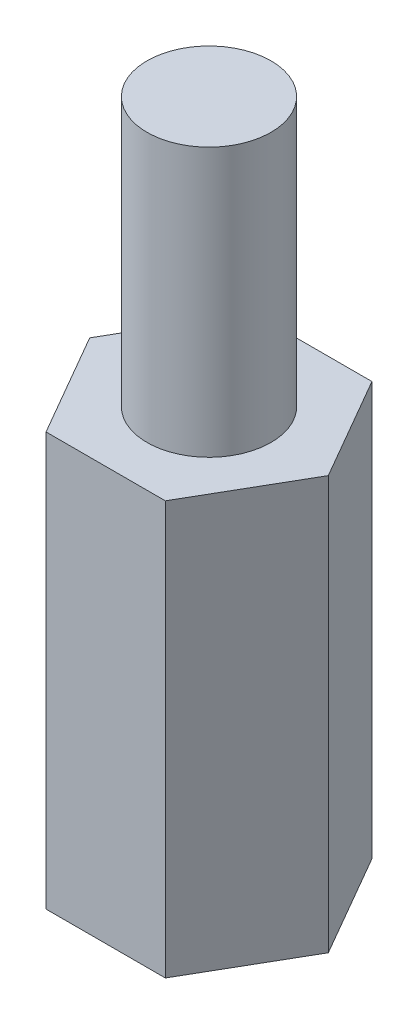
from build123d import *

# Parameters (mm, degrees)
EXTRUDE_1_DEPTH     = 10
SKETCH_2_R          = 1.5
EXTRUDE_2_DEPTH     = 6.5
SKETCH_3_R          = 1.5
CUT_EXTRUDE_1_DEPTH = 6.5


with BuildPart() as part:
    # ｽｹｯﾁ1 → ﾎﾞｽ - 押し出し1 (new body)
    with BuildSketch(Plane(origin=(0, 0, 0), x_dir=(1, 0, 0), z_dir=(0, 1, 0))):
        Polygon((1.443375673, -2.5), (2.886751346, 0), (1.443375673, 2.5), (-1.443375673, 2.5), (-2.886751346, 0), (-1.443375673, -2.5), align=None)
    extrude(amount=EXTRUDE_1_DEPTH)

    # ｽｹｯﾁ2 → ﾎﾞｽ - 押し出し2 (add)
    with BuildSketch(Plane(origin=(0, 10, 0), x_dir=(1, 0, 0), z_dir=(0, 1, 0))):
        with Locations(Location((0, 0, 0), (0, 0, 90))):
            Circle(SKETCH_2_R)
    extrude(amount=EXTRUDE_2_DEPTH)

    # ｽｹｯﾁ3 → ｶｯﾄ - 押し出し1 (cut)
    with BuildSketch(Plane.XZ):
        with Locations(Location((0, 0, 0), (0, 0, 270))):
            Circle(SKETCH_3_R)
    extrude(amount=-CUT_EXTRUDE_1_DEPTH, mode=Mode.SUBTRACT)


solid = part.part
